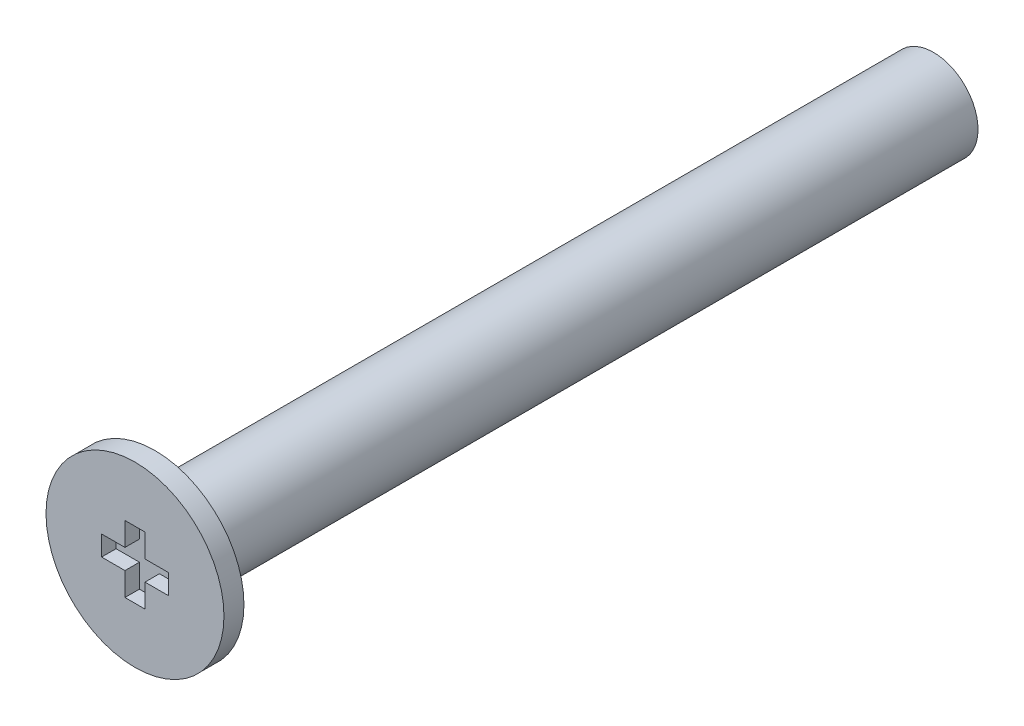
from build123d import *

# Parameters (mm, degrees)
SKETCH_1_R        = 2
EXTRUDE_198_DEPTH = 35
SKETCH_6_W        = 4
SKETCH_6_H        = 0.9
PH2_START         = 0.91
PH2_DEPTH         = 0.66


with BuildPart() as part:
    # 草图1 → Extrude 198 (new body)
    with BuildSketch(Plane.XY):
        Circle(SKETCH_1_R)
    extrude(amount=-EXTRUDE_198_DEPTH)

    # 草图6 → Revolve 324 (revolve)
    with BuildSketch(Plane(origin=(0, 0, 0), x_dir=(1, 0, 0), z_dir=(0, 1, 0)), mode=Mode.PRIVATE) as revolve_324_sk:
        with Locations((2, -0.45)):
            Rectangle(SKETCH_6_W, SKETCH_6_H)
    revolve(revolve_324_sk.sketch.rotate(Axis((0, 0, -2), (0, 0, 1)), 180), axis=Axis((0, 0, -2), (0, 0, 1)))

    # 草图7 → 十字槽_PH2_简化 (cut)
    with BuildSketch(Plane.XY.offset(PH2_START)):
        Polygon((-0.45, -1.5), (0.45, -1.5), (0.45, -0.45), (1.5, -0.45), (1.5, 0.45), (0.45, 0.45), (0.45, 1.5), (-0.45, 1.5), (-0.45, 0.45), (-1.5, 0.45), (-1.5, -0.45), (-0.45, -0.45), align=None)
    extrude(amount=-PH2_DEPTH, mode=Mode.SUBTRACT)


solid = part.part
